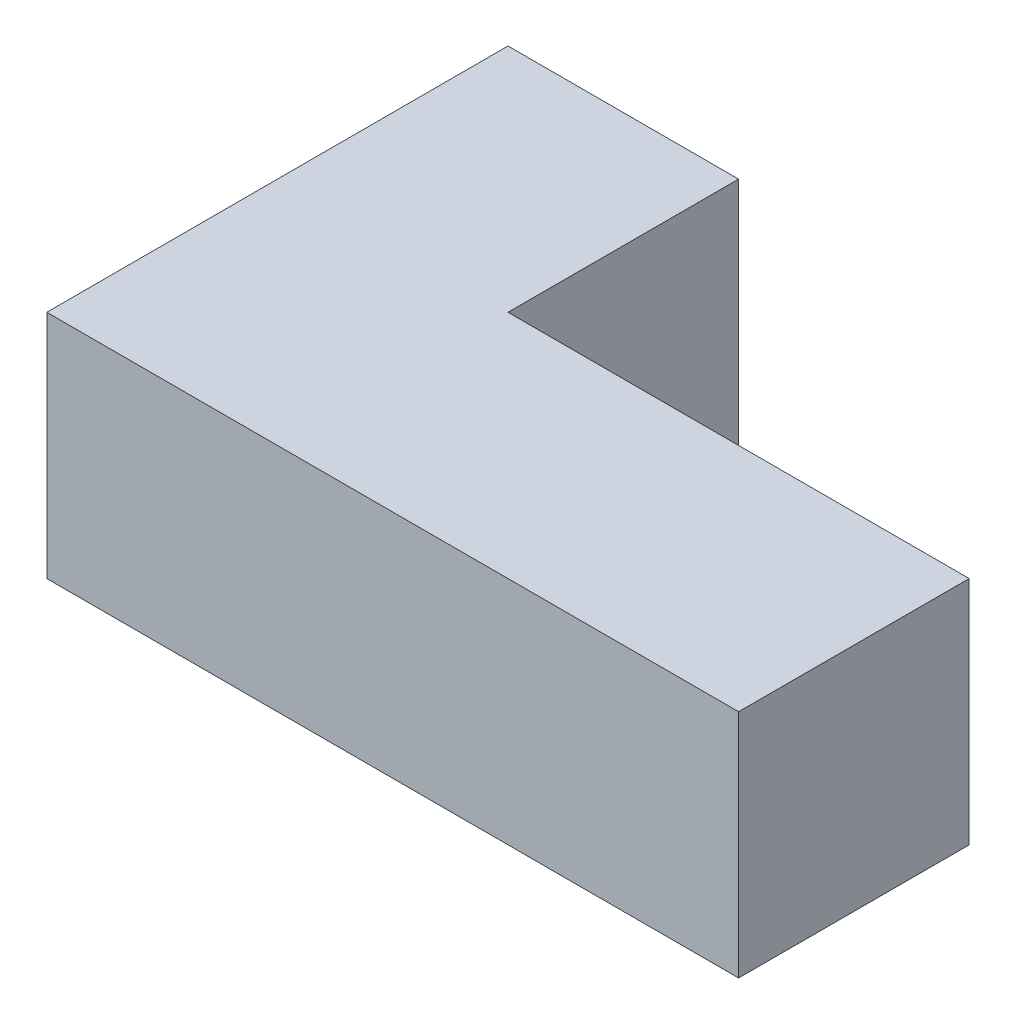
from build123d import *

# Parameters (mm, degrees)
SKETCH_1_W      = 60
SKETCH_1_H      = 30
SKETCH_1_W_2    = 30
EXTRUDE_1_DEPTH = 30
SKETCH_3_W      = 30
SKETCH_3_H      = 30
EXTRUDE_3_DEPTH = 30


with BuildPart() as part:
    # 草圖1 → 填料-伸長1 (new body)
    with BuildSketch(Plane(origin=(0, 0, 0), x_dir=(1, 0, 0), z_dir=(0, 1, 0))):
        with Locations((30, 15)):
            Rectangle(SKETCH_1_W, SKETCH_1_H)
        with Locations((15, 45)):
            Rectangle(SKETCH_1_W_2, SKETCH_1_H)
    extrude(amount=EXTRUDE_1_DEPTH)

    # 草圖3 → 填料-伸長3 (add)
    with BuildSketch(Plane(origin=(60, 0, 0), x_dir=(0, 0, -1), z_dir=(1, 0, 0))):
        with Locations((15, 15)):
            Rectangle(SKETCH_3_W, SKETCH_3_H)
    extrude(amount=EXTRUDE_3_DEPTH)


solid = part.part
